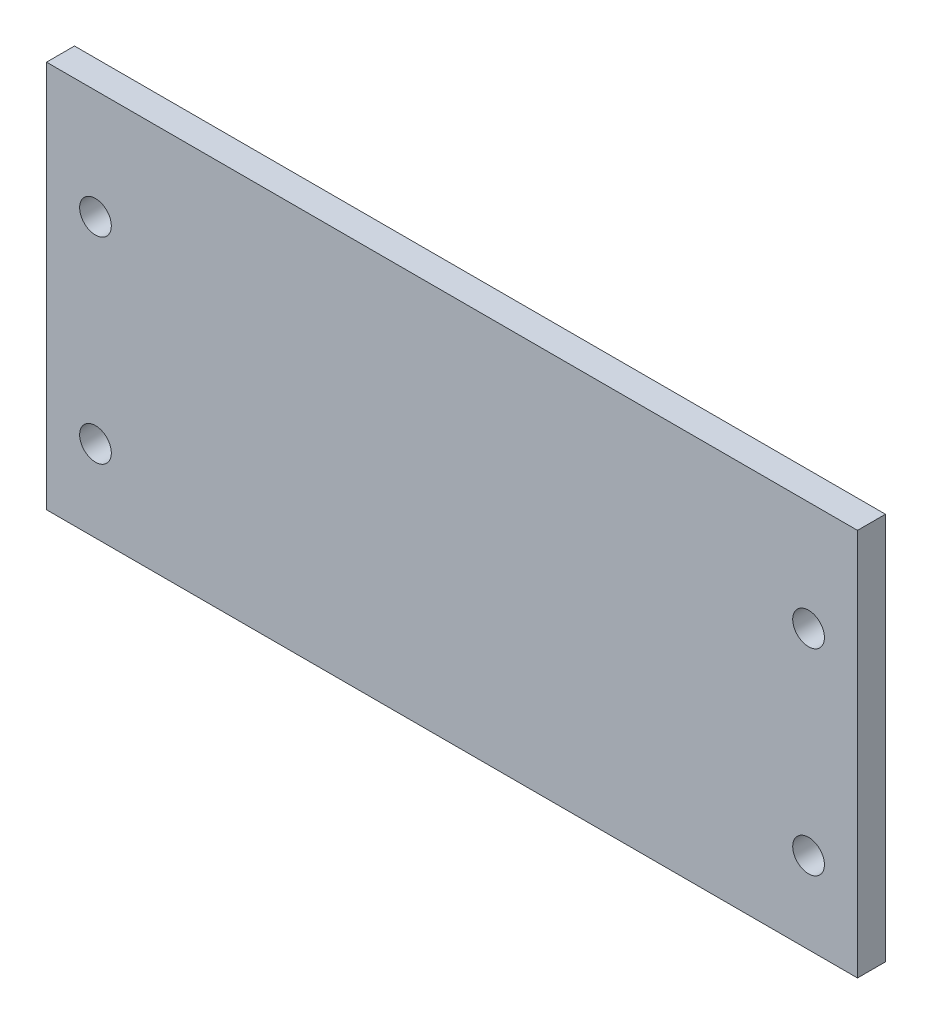
from build123d import *

# Parameters (mm, degrees)
SKETCH1_W           = 87
SKETCH1_H           = 41.59
SKETCH1_R           = 1.7
BOSS_EXTRUDE1_DEPTH = 3


with BuildPart() as part:
    # Sketch1 → Boss-Extrude1 (new body)
    with BuildSketch(Plane.XY):
        with Locations((43.5, 20.795)):
            Rectangle(SKETCH1_W, SKETCH1_H)
        with Locations((81.75, 29.85)):
            Circle(SKETCH1_R, mode=Mode.SUBTRACT)
        with Locations((81.75, 8.75)):
            Circle(SKETCH1_R, mode=Mode.SUBTRACT)
        with Locations((5.25, 8.75)):
            Circle(SKETCH1_R, mode=Mode.SUBTRACT)
        with Locations((5.25, 29.85)):
            Circle(SKETCH1_R, mode=Mode.SUBTRACT)
    extrude(amount=BOSS_EXTRUDE1_DEPTH)


solid = part.part
